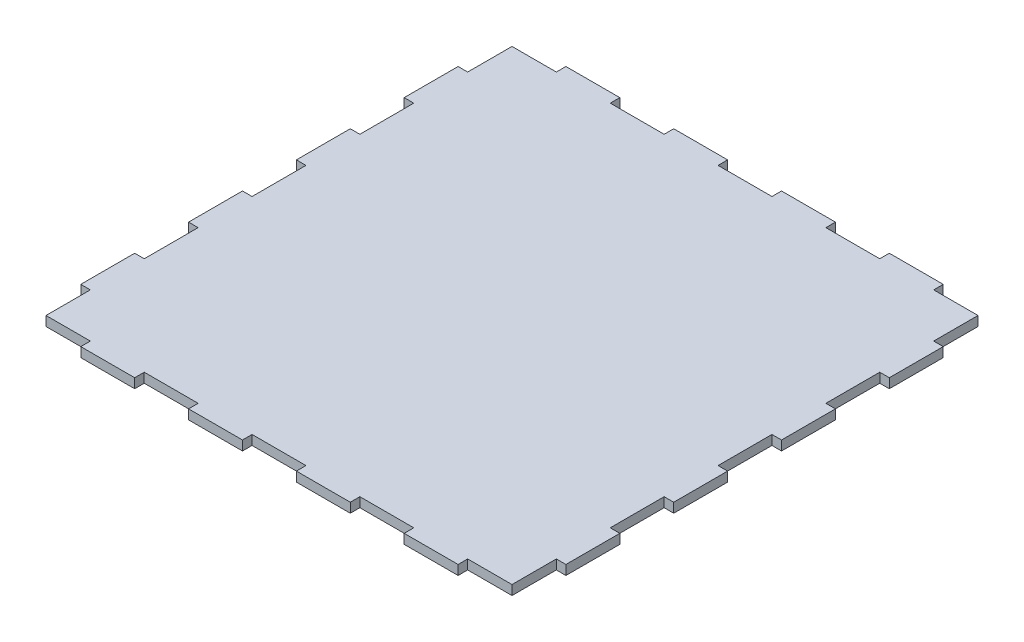
from build123d import *

# Parameters (mm, degrees)
BOSS_EXTRUDE1_DEPTH                      = 3
MIRROR1_AT_THE_SECOND_PLANE_COPY_1_DEPTH = 3


with BuildPart() as part:
    # Sketch1 → Boss-Extrude1 (new body)
    with BuildSketch(Plane(origin=(0, 0, 0), x_dir=(1, 0, 0), z_dir=(0, 1, 0))):
        Polygon((-73, -59.111111111), (-73, -73), (-59.111111111, -73), (-59.111111111, -76), (-42.222222222, -76), (-42.222222222, -73), (-25.333333333, -73), (-25.333333333, -76), (-8.444444444, -76), (-8.444444444, -73), (0, -73), (0, 0), (-73, 0), (-73, -8.444444444), (-76, -8.444444444), (-76, -25.333333333), (-73, -25.333333333), (-73, -42.222222222), (-76, -42.222222222), (-76, -59.111111111), align=None)
    boss_extrude1 = extrude(amount=BOSS_EXTRUDE1_DEPTH)



with BuildPart() as mirror1_1:
    # Mirror1: Boss-Extrude1 across plane
    add(boss_extrude1.mirror(Plane(origin=(0, 0, 0), x_dir=(0, 0, 1), z_dir=(1, 0, 0))))


with BuildPart() as part_1:
    add(part.part)

    add(mirror1_1.part)  # Mirror1 at the second plane merges Mirror1_1
    # Mirror1 at the second plane: Boss-Extrude1 across plane
    add(boss_extrude1.mirror(Plane.XY))

    # Mirror1 at the second plane copy 1 sketc → Mirror1 at the second plane copy 1 (add)
    with BuildSketch(Plane(origin=(0, 0, 0), x_dir=(-1, 0, 0), z_dir=(0, 1, 0))):
        Polygon((-73, -59.111111111), (-73, -73), (-59.111111111, -73), (-59.111111111, -76), (-42.222222222, -76), (-42.222222222, -73), (-25.333333333, -73), (-25.333333333, -76), (-8.444444444, -76), (-8.444444444, -73), (0, -73), (0, 0), (-73, 0), (-73, -8.444444444), (-76, -8.444444444), (-76, -25.333333333), (-73, -25.333333333), (-73, -42.222222222), (-76, -42.222222222), (-76, -59.111111111), align=None)
    extrude(amount=MIRROR1_AT_THE_SECOND_PLANE_COPY_1_DEPTH)


solid = part_1.part
